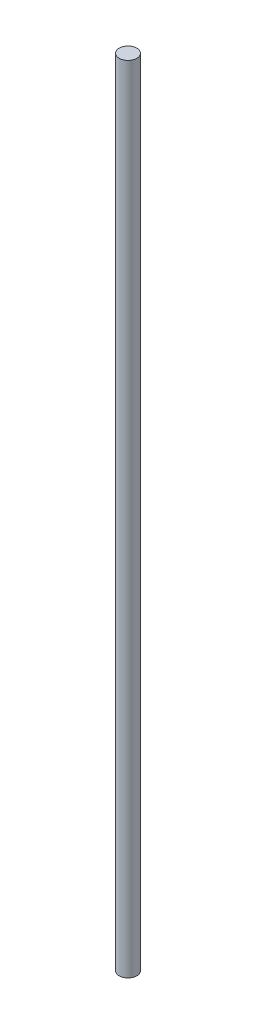
from build123d import *

# Parameters (mm, degrees)
ESQUISSE1_W = 3
ESQUISSE1_H = 270


with BuildPart() as part:
    # Esquisse1 → Révolution1 (revolve)
    with BuildSketch(Plane.XY):
        with Locations((1.5, 135)):
            Rectangle(ESQUISSE1_W, ESQUISSE1_H)
    revolve(axis=Axis((0, 270, 0), (0, -1, 0)))


solid = part.part
